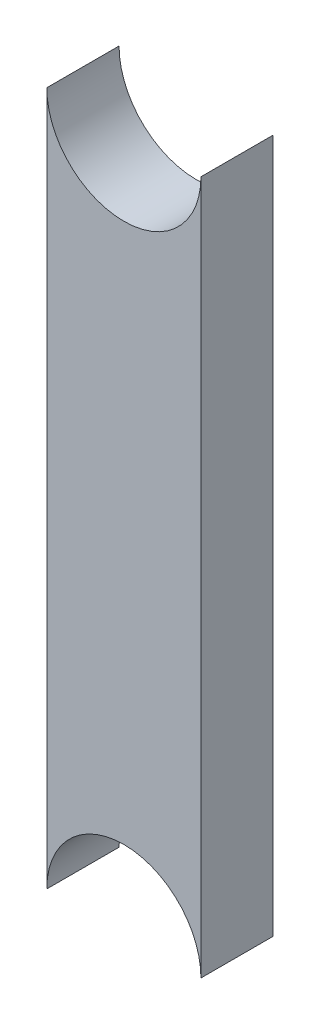
from build123d import *

# Parameters (mm, degrees)
BOSS_EXTRUDE3_DEPTH = 3


with BuildPart() as part:
    # Sketch1 → Boss-Extrude3 (new body)
    with BuildSketch(Plane.XY):
        with BuildLine():
            Line((-3.2, 0), (-3.2, 28.8))
            ThreePointArc((-3.2, 28.8), (0, 25.6), (3.2, 28.8))
            Line((3.2, 28.8), (3.2, 0))
            ThreePointArc((3.2, 0), (0, 3.2), (-3.2, 0))
        make_face()
    extrude(amount=BOSS_EXTRUDE3_DEPTH)


solid = part.part
